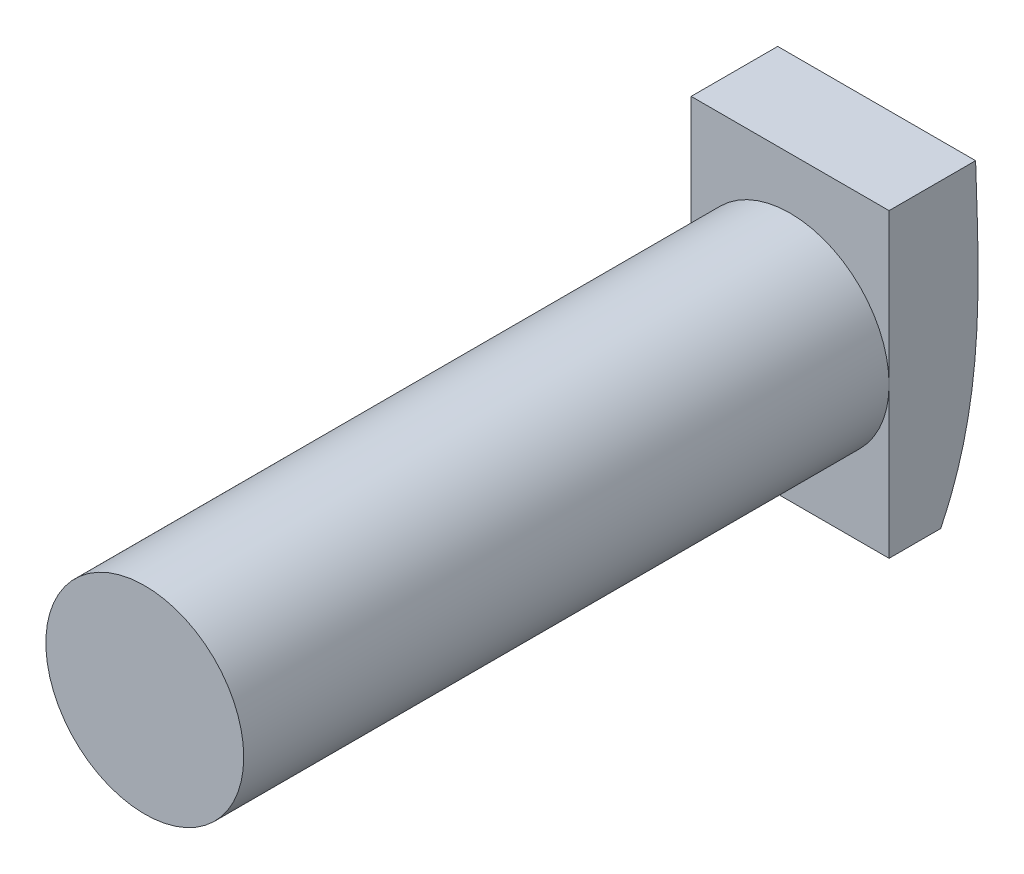
from build123d import *

# Parameters (mm, degrees)
SKETCH1_R           = 2.3
BOSS_EXTRUDE1_DEPTH = 15
SKETCH2_W           = 4.6
SKETCH2_H           = 7
BOSS_EXTRUDE2_DEPTH = 3
CUT_EXTRUDE1_DEPTH  = 4.6


with BuildPart() as part:
    # Sketch1 → Boss-Extrude1 (new body)
    with BuildSketch(Plane.XY):
        Circle(SKETCH1_R)
    extrude(amount=BOSS_EXTRUDE1_DEPTH)

    # Sketch2 → Boss-Extrude2 (add)
    with BuildSketch(Plane(origin=(0, 0, 0), x_dir=(-1, 0, 0), z_dir=(0, 0, -1))):
        Rectangle(SKETCH2_W, SKETCH2_H)
    extrude(amount=BOSS_EXTRUDE2_DEPTH)

    # Sketch3 → Cut-Extrude1 (cut)
    with BuildSketch(Plane(origin=(2.3, 0, 0), x_dir=(0, 0, -1), z_dir=(1, 0, 0))):
        with BuildLine():
            Line((1.2, -3.5), (3, -3.5))
            Line((3, -3.5), (3, 3.5))
            Line((3, 3.5), (2.011534301, 3.5))
            add(Edge.make_bspline(
                [(1.2, -3.5), (2.267514736, -1.334400874), (2.08240034, 1.182388913), (2.011534301, 3.5)],
                knots=[0, 0, 0, 0, 1, 1, 1, 1], degree=3))
        make_face()
    extrude(amount=-CUT_EXTRUDE1_DEPTH, mode=Mode.SUBTRACT)


solid = part.part
